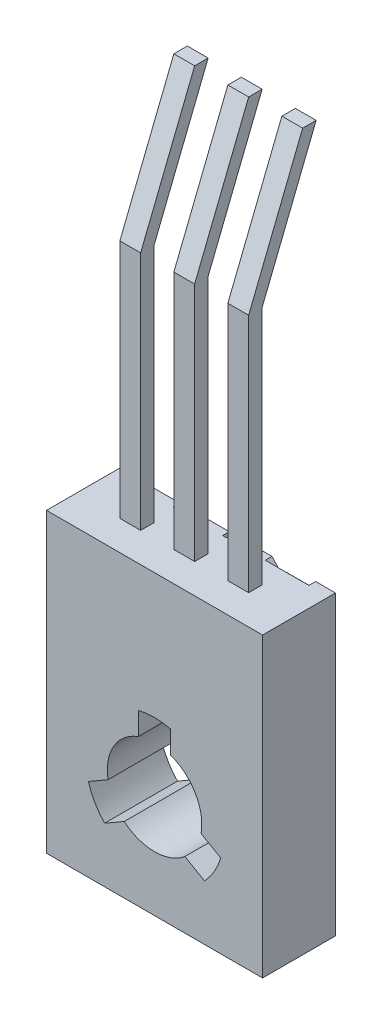
from build123d import *

# Parameters (mm, degrees)
SKETCH1_W           = 8
SKETCH1_H           = 11
SKETCH1_R           = 2.555
BOSS_EXTRUDE1_DEPTH = 1.35
SKETCH2_W           = 0.77
SKETCH2_H           = 0.5
BOSS_EXTRUDE2_DEPTH = 8.9
BOSS_EXTRUDE3_DEPTH = 2.7
CUT_EXTRUDE1_DEPTH  = 0.25
SKETCH6_W           = 0.77
SKETCH6_H           = 0.5


with BuildPart() as part:
    # Sketch1 → Boss-Extrude1 (new, symmetric)
    with BuildSketch(Plane.XY):
        Rectangle(SKETCH1_W, SKETCH1_H)
        with Locations(Location((0, -1.7, 0), (0, 0, 180))):
            Circle(SKETCH1_R, mode=Mode.SUBTRACT)
    extrude(amount=BOSS_EXTRUDE1_DEPTH, both=True)

    # Sketch2 → Boss-Extrude2 (add)
    with BuildSketch(Plane(origin=(0, 5.5, 0), x_dir=(1, 0, 0), z_dir=(0, 1, 0))):
        Rectangle(SKETCH2_W, SKETCH2_H)
        with Locations((-2, 0)):
            Rectangle(SKETCH2_W, SKETCH2_H)
        with Locations((2, 0)):
            Rectangle(SKETCH2_W, SKETCH2_H)
    extrude(amount=BOSS_EXTRUDE2_DEPTH)

    # Sketch4 → Boss-Extrude3 (add)
    with BuildSketch(Plane.XY.offset(1.35)):
        with BuildLine():
            Line((-0.6, 0.823242633), (-0.6, -0.056071778))
            ThreePointArc((-0.6, -0.056071778), (-1.515544457, -0.825), (-1.723683602, -2.002348869))
            Line((-1.723683602, -2.002348869), (-2.48519222, -2.442006074))
            ThreePointArc((-2.48519222, -2.442006074), (-2.246122223, -0.40320073), (-0.6, 0.823242633))
        make_face()
        with BuildLine():
            Line((0.6, 0.823242633), (0.6, -0.056071778))
            ThreePointArc((0.6, -0.056071778), (1.515544457, -0.825), (1.723683602, -2.002348869))
            Line((1.723683602, -2.002348869), (2.48519222, -2.442006074))
            ThreePointArc((2.48519222, -2.442006074), (2.246122223, -0.40320073), (0.6, 0.823242633))
        make_face()
        with BuildLine():
            Line((1.88519222, -3.481236559), (1.123683602, -3.041579353))
            ThreePointArc((1.123683602, -3.041579353), (0, -3.45), (-1.123683602, -3.041579353))
            Line((-1.123683602, -3.041579353), (-1.88519222, -3.481236559))
            ThreePointArc((-1.88519222, -3.481236559), (0, -4.29359854), (1.88519222, -3.481236559))
        make_face()
    extrude(amount=-BOSS_EXTRUDE3_DEPTH)

    # Sketch5 → Cut-Extrude1 (cut)
    # profile 1 of 4: a face of its own
    with BuildSketch(Plane(origin=(0, 0, -1.35), x_dir=(-1, 0, 0), z_dir=(0, 0, -1))):
        with BuildLine():
            Line((3.694711538, 3.11875), (3.230100661, 3.11875))
            add(Edge.make_bspline(
                [(3.230100661, 3.11875), (3.207356998, 3.118867691), (3.16327412, 3.119095804), (3.099176124, 3.122715803), (3.03911853, 3.127528249), (2.983207465, 3.135600868), (2.931079126, 3.143971109), (2.883262725, 3.15625662), (2.839357739, 3.169826413), (2.786636837, 3.190705383), (2.72681775, 3.223130685), (2.662523425, 3.27122049), (2.606634875, 3.328876282), (2.55911304, 3.394579606), (2.520975757, 3.466860707), (2.493734166, 3.544164435), (2.47623313, 3.625190247), (2.474455884, 3.680740932), (2.473557692, 3.708815355)],
                knots=[0, 0, 0, 0, 1.00128172, 1.940733171, 2.826250472, 3.653024905, 4.427672124, 5.149348099, 5.824709082, 6.450061444, 7.643590664, 8.808605388, 9.972104426, 11.165284501, 12.367876273, 13.557044126, 14.765369432, 16, 16, 16, 16], degree=3))
            add(Edge.make_bspline(
                [(2.473557692, 3.708815355), (2.474291348, 3.735116255), (2.47573305, 3.786800005), (2.489817315, 3.862140053), (2.511077172, 3.934083045), (2.541756436, 4.001935669), (2.580875076, 4.065101707), (2.628468779, 4.122503706), (2.684901867, 4.173014677), (2.727272141, 4.201124751), (2.748794321, 4.215403395)],
                knots=[0, 0, 0, 0, 1.044356178, 2.052258378, 3.035953355, 4.020338374, 5.002448483, 5.980768927, 6.974322109, 8, 8, 8, 8], degree=3))
            add(Edge.make_bspline(
                [(2.748794321, 4.215403395), (2.72174111, 4.22578439), (2.669981617, 4.245645804), (2.598661695, 4.280896555), (2.537194013, 4.318943259), (2.484786419, 4.360064788), (2.440872559, 4.405603876), (2.401752329, 4.454361221), (2.368552192, 4.508034876), (2.340225068, 4.565461757), (2.317785485, 4.626337754), (2.302209294, 4.690207441), (2.292330824, 4.756347407), (2.291039034, 4.801299577), (2.290384615, 4.824072266)],
                knots=[0, 0, 0, 0, 1.272200328, 2.434034374, 3.488177493, 4.442517805, 5.351202203, 6.260825393, 7.183200622, 8.11705787, 9.069326169, 10.026320267, 11.000137371, 12, 12, 12, 12], degree=3))
            add(Edge.make_bspline(
                [(2.290384615, 4.824072266), (2.291049283, 4.847317902), (2.292357036, 4.893054344), (2.30200357, 4.960243658), (2.318341686, 5.024450297), (2.340829557, 5.086101648), (2.370143628, 5.144836638), (2.405558072, 5.201116858), (2.448062875, 5.254108227), (2.495927463, 5.304579715), (2.549330573, 5.35073371), (2.608176622, 5.390396936), (2.670957447, 5.424655695), (2.738532756, 5.452197816), (2.810423057, 5.473758258), (2.886645191, 5.488665113), (2.967155875, 5.498749693), (3.022408312, 5.499576159), (3.05074369, 5.5)],
                knots=[0, 0, 0, 0, 0.978522333, 1.925270105, 2.85076145, 3.763600118, 4.682725947, 5.609499657, 6.557784645, 7.537954401, 8.534920712, 9.522742111, 10.520247711, 11.5409147, 12.58930695, 13.675078472, 14.807699069, 16, 16, 16, 16], degree=3))
            Line((3.05074369, 5.5), (3.694711538, 5.5))
            Line((3.694711538, 5.5), (3.694711538, 3.11875))
        make_face()
        with BuildLine():
            Line((3.481009615, 3.362980769), (3.481009615, 4.126201923))
            Line((3.481009615, 4.126201923), (3.337428636, 4.126201923))
            add(Edge.make_bspline(
                [(3.337428636, 4.126201923), (3.316440249, 4.125932097), (3.275886407, 4.125410738), (3.217001979, 4.123870219), (3.16247998, 4.119745598), (3.112132548, 4.115383123), (3.066297095, 4.108665833), (3.024820303, 4.10044567), (2.987329169, 4.091828369), (2.944114595, 4.077130969), (2.895101859, 4.055637123), (2.843218718, 4.021463602), (2.796521558, 3.981898053), (2.757999097, 3.934967129), (2.72592775, 3.884285976), (2.704335357, 3.829476662), (2.689280338, 3.772427931), (2.687940089, 3.733084175), (2.687259615, 3.713108474)],
                knots=[0, 0, 0, 0, 1.156584208, 2.234756387, 3.244705828, 4.168772894, 5.018724976, 5.795346628, 6.498686023, 7.135894168, 8.308330183, 9.43588092, 10.547699294, 11.667188675, 12.76860303, 13.837480448, 14.902040606, 16, 16, 16, 16], degree=3))
            add(Edge.make_bspline(
                [(2.687259615, 3.713108474), (2.687591494, 3.699884123), (2.688242509, 3.673943115), (2.694379887, 3.636148556), (2.702849395, 3.600183072), (2.716817723, 3.567016229), (2.733366583, 3.535483404), (2.754578267, 3.506580657), (2.779037291, 3.479525011), (2.807553447, 3.455041667), (2.840010168, 3.432897895), (2.877435605, 3.414464262), (2.918812252, 3.398082518), (2.965002941, 3.385664771), (3.015087596, 3.374884191), (3.069830331, 3.368086017), (3.128901229, 3.363718762), (3.169829202, 3.363232254), (3.190985577, 3.362980769)],
                knots=[0, 0, 0, 0, 0.911412742, 1.787835618, 2.63643285, 3.453173233, 4.262886967, 5.08783453, 5.918594724, 6.773969545, 7.67442701, 8.62112486, 9.645634318, 10.739428598, 11.916091468, 13.177237585, 14.540865421, 16, 16, 16, 16], degree=3))
            Line((3.190985577, 3.362980769), (3.481009615, 3.362980769))
        make_face(mode=Mode.SUBTRACT)
        with BuildLine():
            Line((3.481009615, 4.370432692), (3.481009615, 5.255769231))
            Line((3.481009615, 5.255769231), (3.17667518, 5.255769231))
            add(Edge.make_bspline(
                [(3.17667518, 5.255769231), (3.154893053, 5.25548304), (3.112910874, 5.254931446), (3.052249707, 5.253622588), (2.996324753, 5.24876673), (2.94467038, 5.244111232), (2.897525586, 5.236505511), (2.854431809, 5.229140548), (2.816373329, 5.218302642), (2.771842711, 5.20338949), (2.722035661, 5.179556297), (2.667644013, 5.144507546), (2.619736285, 5.101815585), (2.579089935, 5.052658214), (2.545294276, 4.99976077), (2.521914355, 4.94301914), (2.506765498, 4.884328587), (2.504981322, 4.84419814), (2.504086538, 4.824072266)],
                knots=[0, 0, 0, 0, 1.16016216, 2.236059617, 3.229676189, 4.14889023, 4.996733752, 5.772278665, 6.474820656, 7.101410824, 8.271817372, 9.403828207, 10.537358096, 11.673541442, 12.791884111, 13.865947414, 14.929748409, 16, 16, 16, 16], degree=3))
            add(Edge.make_bspline(
                [(2.504086538, 4.824072266), (2.504269191, 4.811488302), (2.504631551, 4.786523356), (2.510327482, 4.749868856), (2.518231977, 4.714186742), (2.529880982, 4.679961695), (2.543973111, 4.646604365), (2.562564219, 4.615200139), (2.583534852, 4.584412188), (2.616015191, 4.54503099), (2.663902354, 4.500204911), (2.731975647, 4.456865792), (2.808944578, 4.421348032), (2.864900801, 4.406332901), (2.89380634, 4.398576472)],
                knots=[0, 0, 0, 0, 0.723354195, 1.435040621, 2.129761981, 2.824182007, 3.512608497, 4.209435533, 4.920062464, 5.654614313, 7.143585817, 8.671381114, 10.280521501, 12, 12, 12, 12], degree=3))
            add(Edge.make_bspline(
                [(2.89380634, 4.398576472), (2.905392196, 4.396225623), (2.930512722, 4.391128498), (2.971475588, 4.385751474), (3.018397339, 4.380928108), (3.071077424, 4.377453937), (3.129725358, 4.373724476), (3.1943223, 4.3723257), (3.264913917, 4.370618421), (3.313894502, 4.370496185), (3.339336689, 4.370432692)],
                knots=[0, 0, 0, 0, 0.634452549, 1.375623993, 2.216454381, 3.166361212, 4.209414599, 5.370755378, 6.634280627, 8, 8, 8, 8], degree=3))
            Line((3.339336689, 4.370432692), (3.481009615, 4.370432692))
        make_face(mode=Mode.SUBTRACT)
    # profile 2 of 4: a face of its own
    with BuildSketch(Plane(origin=(0, 0, -1.35), x_dir=(-1, 0, 0), z_dir=(0, 0, -1))):
        Polygon((1.862980769, 3.11875), (0.397596154, 3.11875), (1.649278846, 5.561057692), (1.833882963, 5.459453876), (0.759172175, 3.362980769), (1.862980769, 3.362980769), align=None)
    # profile 3 of 4: a face of its own
    with BuildSketch(Plane(origin=(0, 0, -1.35), x_dir=(-1, 0, 0), z_dir=(0, 0, -1))):
        Polygon((0.03125, 3.11875), (-1.434134615, 3.11875), (-0.182451923, 5.561057692), (0.002152194, 5.459453876), (-1.072558594, 3.362980769), (0.03125, 3.362980769), align=None)
    # profile 4 of 4: a face of its own
    with BuildSketch(Plane(origin=(0, 0, -1.35), x_dir=(-1, 0, 0), z_dir=(0, 0, -1))):
        with BuildLine():
            Line((-1.953125, 3.851442308), (-1.739423077, 3.851442308))
            add(Edge.make_bspline(
                [(-1.739423077, 3.851442308), (-1.740815635, 3.823091082), (-1.743550582, 3.767410029), (-1.756363898, 3.686229134), (-1.774681175, 3.60862398), (-1.80064103, 3.535259888), (-1.832699183, 3.465260463), (-1.871947639, 3.399555216), (-1.917549686, 3.337492029), (-1.969421663, 3.280245966), (-2.025707539, 3.227915907), (-2.086070075, 3.182248012), (-2.149888856, 3.14410457), (-2.216610346, 3.112044128), (-2.2870062, 3.088008093), (-2.360403511, 3.070165916), (-2.437134028, 3.059432938), (-2.489412627, 3.05827912), (-2.516000601, 3.057692308)],
                knots=[0, 0, 0, 0, 1.100776268, 2.161895295, 3.184016182, 4.190939212, 5.176500551, 6.166955529, 7.155448256, 8.160289653, 9.16017456, 10.133824356, 11.091467644, 12.04088621, 13.000931625, 13.972173743, 14.968683325, 16, 16, 16, 16], degree=3))
            add(Edge.make_bspline(
                [(-2.516000601, 3.057692308), (-2.542113235, 3.058298618), (-2.593423629, 3.059489997), (-2.668279112, 3.069875086), (-2.739709196, 3.085789309), (-2.806904363, 3.10937168), (-2.870554226, 3.138962397), (-2.929870692, 3.175762331), (-2.986288098, 3.218030232), (-3.037037573, 3.267887294), (-3.083657088, 3.321084906), (-3.123840292, 3.377899507), (-3.158446383, 3.436647555), (-3.186770388, 3.497787956), (-3.208241243, 3.561519813), (-3.224149089, 3.627232108), (-3.233242873, 3.695683204), (-3.234630871, 3.742021319), (-3.235336538, 3.765579928)],
                knots=[0, 0, 0, 0, 1.111674182, 2.184400057, 3.212814286, 4.223731311, 5.211378316, 6.196328225, 7.191884489, 8.207283132, 9.220262353, 10.201199469, 11.166417575, 12.120932471, 13.06540007, 14.026332106, 14.996573967, 16, 16, 16, 16], degree=3))
            add(Edge.make_bspline(
                [(-3.235336538, 3.765579928), (-3.234184497, 3.798745851), (-3.23190063, 3.864495682), (-3.212364865, 3.961116718), (-3.18185221, 4.054728587), (-3.145117979, 4.130072069), (-3.108049975, 4.190776967), (-3.074679732, 4.240783057), (-3.035392175, 4.294612004), (-2.990522959, 4.352481678), (-2.939299372, 4.413634228), (-2.883052198, 4.47931733), (-2.820328832, 4.548316458), (-2.776344674, 4.595474494), (-2.753553185, 4.619910607)],
                knots=[0, 0, 0, 0, 1.184416499, 2.348048165, 3.509039915, 4.696071444, 5.333504901, 6.05069495, 6.844171097, 7.714965912, 8.667477798, 9.695072654, 10.805644396, 12, 12, 12, 12], degree=3))
            Line((-2.753553185, 4.619910607), (-2.157763672, 5.255769231))
            Line((-2.157763672, 5.255769231), (-3.265865385, 5.255769231))
            Line((-3.265865385, 5.255769231), (-3.265865385, 5.5))
            Line((-3.265865385, 5.5), (-1.647836538, 5.5))
            Line((-1.647836538, 5.5), (-2.571334135, 4.514490685))
            add(Edge.make_bspline(
                [(-2.571334135, 4.514490685), (-2.593820092, 4.491020796), (-2.637011015, 4.445939942), (-2.698074289, 4.380103336), (-2.753007148, 4.319097523), (-2.801846031, 4.262652174), (-2.844631122, 4.211087279), (-2.881225529, 4.163998737), (-2.911790993, 4.121790649), (-2.944184014, 4.072206352), (-2.97507291, 4.011595014), (-3.002221089, 3.937897371), (-3.018656227, 3.861863655), (-3.020637845, 3.810497881), (-3.021634615, 3.784660457)],
                knots=[0, 0, 0, 0, 1.329530082, 2.553755191, 3.672934919, 4.687409497, 5.60679272, 6.413407421, 7.126401618, 7.737995624, 8.834647426, 9.90044882, 10.943907757, 12, 12, 12, 12], degree=3))
            add(Edge.make_bspline(
                [(-3.021634615, 3.784660457), (-3.021206527, 3.768410781), (-3.020362846, 3.736385791), (-3.012775914, 3.689462992), (-3.001629205, 3.644024979), (-2.984448683, 3.600633561), (-2.963806919, 3.558435313), (-2.937435543, 3.518713193), (-2.907299986, 3.480113169), (-2.872344217, 3.443958804), (-2.833969279, 3.410835792), (-2.793422588, 3.381496641), (-2.750526343, 3.356977011), (-2.705459311, 3.336876925), (-2.658347686, 3.321109377), (-2.609100201, 3.310183811), (-2.557852971, 3.30332412), (-2.522859824, 3.302395996), (-2.505029297, 3.301923077)],
                knots=[0, 0, 0, 0, 0.991504627, 1.954065223, 2.895985987, 3.842598665, 4.797835564, 5.759220273, 6.74786863, 7.784730864, 8.824135544, 9.839918996, 10.835834653, 11.835434876, 12.84861661, 13.863796685, 14.911511676, 16, 16, 16, 16], degree=3))
            add(Edge.make_bspline(
                [(-2.505029297, 3.301923077), (-2.486402599, 3.302390211), (-2.449822838, 3.303307585), (-2.396231062, 3.310260523), (-2.344748424, 3.320790393), (-2.296168255, 3.33755386), (-2.24947386, 3.357173308), (-2.205856436, 3.382577042), (-2.164090715, 3.411604737), (-2.12501641, 3.445449185), (-2.089428161, 3.48365447), (-2.057053213, 3.525240247), (-2.029621599, 3.570943748), (-2.005270831, 3.619668304), (-1.986647302, 3.672752581), (-1.970725519, 3.728898337), (-1.959160166, 3.78890664), (-1.955170135, 3.830250867), (-1.953125, 3.851442308)],
                knots=[0, 0, 0, 0, 1.031072318, 2.024855787, 2.988461151, 3.935103592, 4.865765533, 5.788564469, 6.724086513, 7.67908574, 8.64457978, 9.611397706, 10.591395687, 11.591555111, 12.622101007, 13.700900657, 14.821571223, 16, 16, 16, 16], degree=3))
        make_face()
    extrude(amount=-CUT_EXTRUDE1_DEPTH, mode=Mode.SUBTRACT)

    # Sweep1: sweep along a path in Sketch7
    with BuildLine(Plane(origin=(0, 0, 0), x_dir=(0, 0, -1), z_dir=(1, 0, 0))) as sweep1_path:
        Line((0, 14.4), (2, 19.4))
    # Sketch6 → Sweep1 (sweep)
    with BuildSketch(Plane(origin=(0, 14.4, 0), x_dir=(1, 0, 0), z_dir=(0, 1, 0))):
        with Locations((2, 0)):
            Rectangle(SKETCH6_W, SKETCH6_H)
        Rectangle(SKETCH6_W, SKETCH6_H)
        with Locations((-2, 0)):
            Rectangle(SKETCH6_W, SKETCH6_H)
    sweep(path=sweep1_path.line)


solid = part.part
